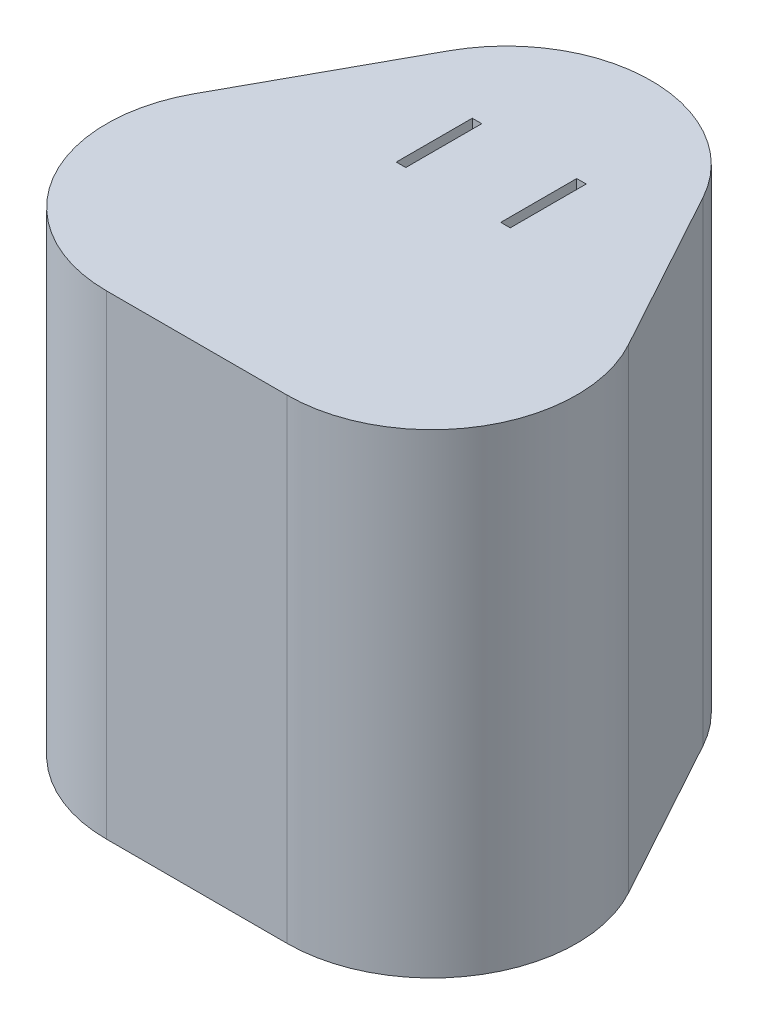
from build123d import *

# Parameters (mm, degrees)
RESSALTO_EXTRUS_O2_DEPTH = 50
CORTE_EXTRUS_O1_DEPTH    = 38
CORTE_EXTRUS_O3_DEPTH    = 47
ESBO_O5_W                = 1
ESBO_O5_H                = 8
CORTE_EXTRUS_O4_DEPTH    = 61.725636267
CORTE_EXTRUS_O5_DEPTH    = 7
CORTE_EXTRUS_O6_DEPTH    = 47


with BuildPart() as part:
    # Esboço1 → Ressalto-extrusão2 (new body)
    with BuildSketch(Plane(origin=(0, 0, 0), x_dir=(1, 0, 0), z_dir=(0, 1, 0))):
        with BuildLine():
            Line((-13.376104721, 16.054091922), (-22.876104721, -1.295908078))
            ThreePointArc((-22.876104721, -1.295908078), (-22.619735169, -16.393998269), (-9.5, -23.87))
            Line((-9.5, -23.87), (9.5, -23.87))
            ThreePointArc((9.5, -23.87), (22.619735169, -16.393998269), (22.876104721, -1.295908078))
            Line((22.876104721, -1.295908078), (13.376104721, 16.054091922))
            ThreePointArc((13.376104721, 16.054091922), (0, 23.98), (-13.376104721, 16.054091922))
        make_face()
    extrude(amount=RESSALTO_EXTRUS_O2_DEPTH)

    # Esboço3 → Corte-extrusão1 (cut)
    with BuildSketch(Plane.XZ):
        with BuildLine():
            Line((-9.5, 19.37), (9.5, 19.37))
            ThreePointArc((9.5, 19.37), (18.748337906, 14.100031567), (18.929057426, 3.45711553))
            Line((18.929057426, 3.45711553), (9.429057426, -13.89288447))
            ThreePointArc((9.429057426, -13.89288447), (0, -19.48), (-9.429057426, -13.89288447))
            Line((-9.429057426, -13.89288447), (-18.929057426, 3.45711553))
            ThreePointArc((-18.929057426, 3.45711553), (-18.748337906, 14.100031567), (-9.5, 19.37))
        make_face()
    extrude(amount=-CORTE_EXTRUS_O1_DEPTH, mode=Mode.SUBTRACT)

    # Esboço4 → Corte-extrusão3 (cut)
    with BuildSketch(Plane.XZ):
        with BuildLine():
            Line((0, 3.37), (18.88135728, 3.37))
            Line((18.88135728, 3.37), (9.429057426, -13.89288447))
            ThreePointArc((9.429057426, -13.89288447), (0, -19.48), (-9.429057426, -13.89288447))
            Line((-9.429057426, -13.89288447), (-18.88135728, 3.37))
            Line((-18.88135728, 3.37), (0, 3.37))
        make_face()
    extrude(amount=-CORTE_EXTRUS_O3_DEPTH, mode=Mode.SUBTRACT)

    # Esboço5 → Corte-extrusão4 (cut, through all)
    with BuildSketch(Plane(origin=(0, 0, 0), x_dir=(-1, 0, 0), z_dir=(0, -1, 0))):
        with Locations((-5.5, 7.13)):
            Rectangle(ESBO_O5_W, ESBO_O5_H)
        with Locations((5.5, 7.13)):
            Rectangle(ESBO_O5_W, ESBO_O5_H)
    extrude(amount=-CORTE_EXTRUS_O4_DEPTH, mode=Mode.SUBTRACT)

    # Esboço6 → Corte-extrusão5 (cut)
    with BuildSketch(Plane.XZ):
        Polygon((-13.774214885, -10.63), (13.780859913, -10.63), (19.256364236, -0.63), (2.792834358, -0.63), (-19.234396653, -0.63), align=None)
    extrude(amount=-CORTE_EXTRUS_O5_DEPTH, mode=Mode.SUBTRACT)

    # Esboço7 → Corte-extrusão6 (cut)
    with BuildSketch(Plane.XZ):
        Polygon((0, -12.48), (13, -12.48), (13, -8.48), (-13, -8.48), (-13, -12.48), align=None)
    extrude(amount=-CORTE_EXTRUS_O6_DEPTH, mode=Mode.SUBTRACT)


solid = part.part
